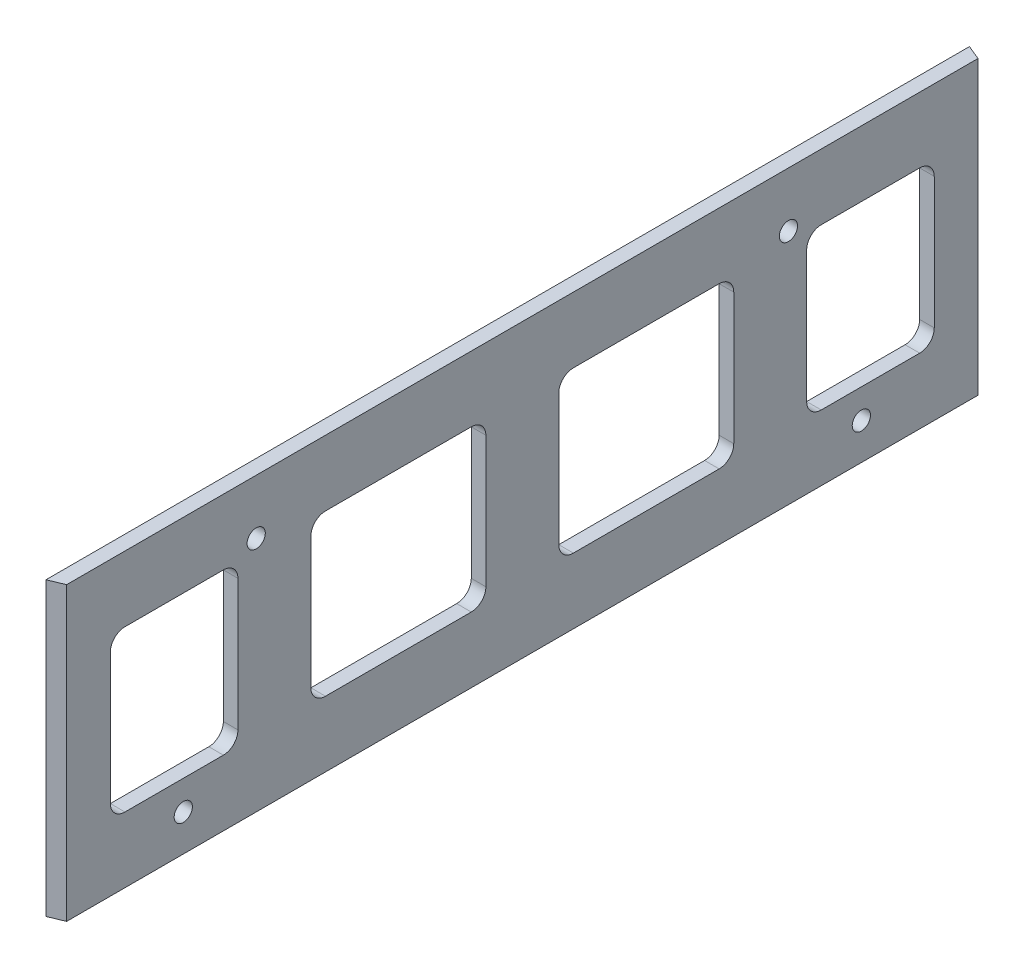
from build123d import *

# Parameters (mm, degrees)
SKETCH_1_W          = 4
SKETCH_1_H          = 80
EXTRUDE_3_DEPTH     = 250
EXTRUDE_4_DEPTH     = 80
EXTRUDE_5_DEPTH     = 80
SKETCH_8_W          = 35
SKETCH_8_H          = 44
SKETCH_8_W_2        = 48
CUT_EXTRUDE_1_DEPTH = 258.627972648
SKETCH_2_R          = 2.5
CUT_EXTRUDE_2_DEPTH = 258.627972648
FILLET_1_R          = 4
FILLET_2_R          = 4
FILLET_3_R          = 4
FILLET_4_R          = 4


with BuildPart() as part:
    # 草图1 → 拉伸3 (new body)
    with BuildSketch(Plane.XY):
        with Locations((-2, 15)):
            Rectangle(SKETCH_1_W, SKETCH_1_H)
    extrude(amount=-EXTRUDE_3_DEPTH)

    # 草图4 → 拉伸4 (add)
    with BuildSketch(Plane.XZ.offset(25)):
        Polygon((-4, 0), (-4, 1.656854249), (0, 0), align=None)
    extrude(amount=-EXTRUDE_4_DEPTH)

    # 草图6 → 拉伸5 (add)
    with BuildSketch(Plane.XZ.offset(25)):
        Polygon((-4, -250), (-4, -251.656854249), (0, -250), align=None)
    extrude(amount=-EXTRUDE_5_DEPTH)

    # 草图8 → 切除-拉伸1 (cut, through all)
    with BuildSketch(Plane(origin=(0, 0, 0), x_dir=(0, 0, -1), z_dir=(1, 0, 0))):
        with Locations((29.5, 15)):
            Rectangle(SKETCH_8_W, SKETCH_8_H)
        with Locations((91, 15)):
            Rectangle(SKETCH_8_W_2, SKETCH_8_H)
        with Locations((159, 15)):
            Rectangle(SKETCH_8_W_2, SKETCH_8_H)
        with Locations((220.5, 15)):
            Rectangle(SKETCH_8_W, SKETCH_8_H)
    extrude(amount=-CUT_EXTRUDE_1_DEPTH, mode=Mode.SUBTRACT)

    # 草图2 → 切除-拉伸2 (cut, through all)
    with BuildSketch(Plane.ZY.offset(4)):
        with Locations(Location((-198, 40, 0), (0, 0, 270))):
            Circle(SKETCH_2_R)
        with Locations(Location((-218, -15, 0), (0, 0, 270))):
            Circle(SKETCH_2_R)
        with Locations(Location((-52, 40, 0), (0, 0, 270))):
            Circle(SKETCH_2_R)
        with Locations(Location((-32, -15, 0), (0, 0, 270))):
            Circle(SKETCH_2_R)
    extrude(amount=-CUT_EXTRUDE_2_DEPTH, mode=Mode.SUBTRACT)

    # 圆角1
    fillet_1_edges = [part.edges().sort_by_distance(p)[0] for p in [
        (-2, -7, -12),
        (-2, 37, -12),
        (-2, 37, -47),
        (-2, -7, -47),
    ]]
    fillet(fillet_1_edges, radius=FILLET_1_R)

    # 圆角2
    fillet_2_edges = [part.edges().sort_by_distance(p)[0] for p in [
        (-2, -7, -67),
        (-2, 37, -67),
        (-2, 37, -115),
        (-2, -7, -115),
    ]]
    fillet(fillet_2_edges, radius=FILLET_2_R)

    # 圆角3
    fillet_3_edges = [part.edges().sort_by_distance(p)[0] for p in [
        (-2, -7, -135),
        (-2, 37, -135),
        (-2, 37, -183),
        (-2, -7, -183),
    ]]
    fillet(fillet_3_edges, radius=FILLET_3_R)

    # 圆角4
    fillet_4_edges = [part.edges().sort_by_distance(p)[0] for p in [
        (-2, -7, -203),
        (-2, 37, -203),
        (-2, 37, -238),
        (-2, -7, -238),
    ]]
    fillet(fillet_4_edges, radius=FILLET_4_R)


solid = part.part
